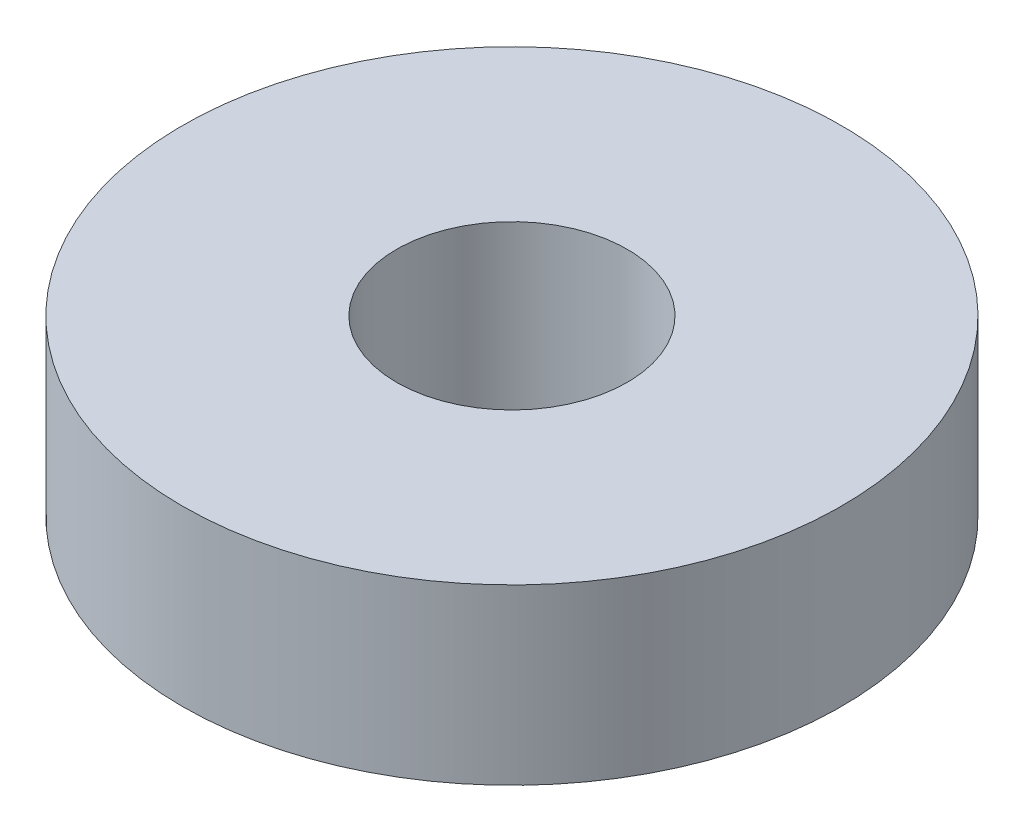
from build123d import *

# Parameters (mm, degrees)
SKETCH1_R           = 7.62
BOSS_EXTRUDE1_DEPTH = 4.0132
SKETCH2_R           = 2.667
CUT_EXTRUDE1_DEPTH  = 4.0132


with BuildPart() as part:
    # Sketch1 → Boss-Extrude1 (new body)
    with BuildSketch(Plane(origin=(0, 0, 0), x_dir=(1, 0, 0), z_dir=(0, 1, 0))):
        with Locations(Location((0, 0, 0), (0, 0, 270))):
            Circle(SKETCH1_R)
    extrude(amount=BOSS_EXTRUDE1_DEPTH)

    # Sketch2 → Cut-Extrude1 (cut)
    with BuildSketch(Plane(origin=(0, 4.0132, 0), x_dir=(1, 0, 0), z_dir=(0, 1, 0))):
        with Locations(Location((0, 0, 0), (0, 0, 270))):
            Circle(SKETCH2_R)
    extrude(amount=-CUT_EXTRUDE1_DEPTH, mode=Mode.SUBTRACT)


solid = part.part
